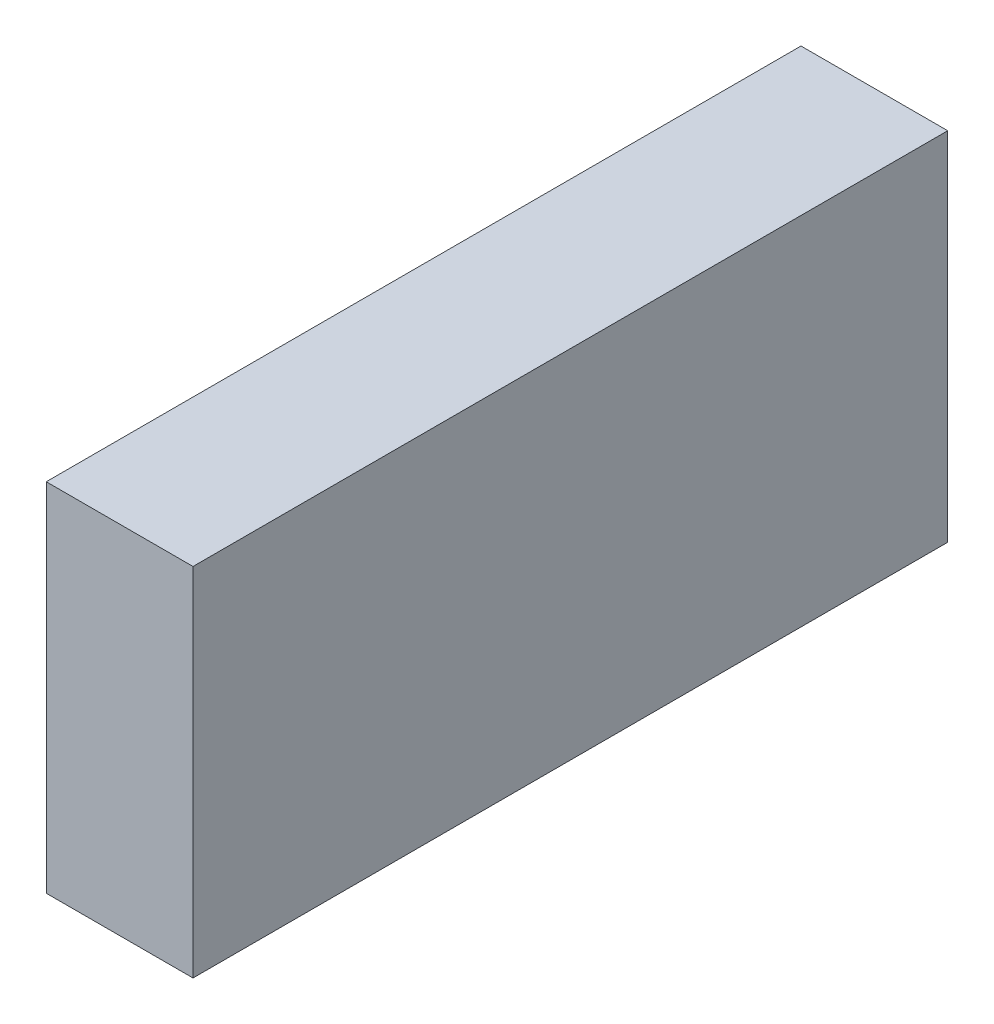
from build123d import *

# Parameters (mm, degrees)
SKETCH1_W           = 72
SKETCH1_H           = 34
BOSS_EXTRUDE1_DEPTH = 7


with BuildPart() as part:
    # Sketch1 → Boss-Extrude1 (new, symmetric)
    with BuildSketch(Plane(origin=(0, 0, 0), x_dir=(0, 0, -1), z_dir=(1, 0, 0))):
        Rectangle(SKETCH1_W, SKETCH1_H)
    extrude(amount=BOSS_EXTRUDE1_DEPTH, both=True)


solid = part.part
